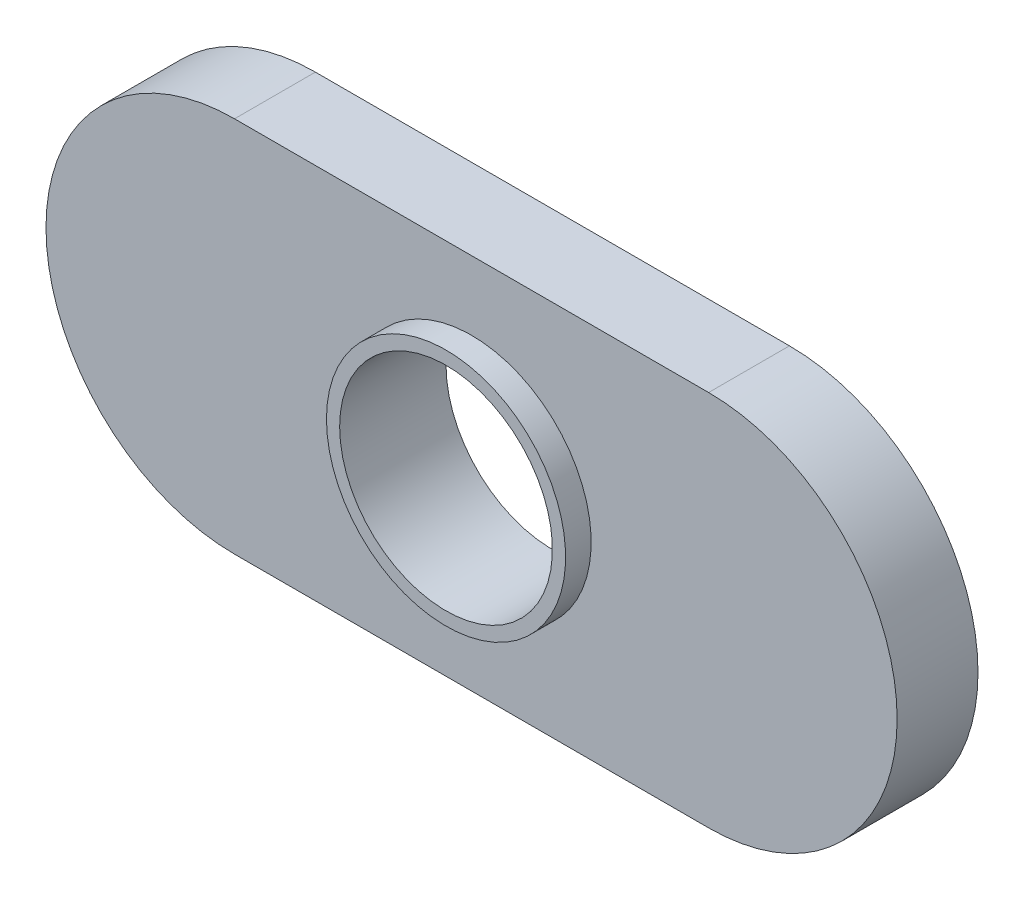
from build123d import *

# Parameters (mm, degrees)
EXTRUDE1_DEPTH     = 2.413
SKETCH4_R          = 3.5687
EXTRUDE3_DEPTH     = 0.762
SKETCH6_R          = 3.175
CUT_EXTRUDE1_DEPTH = 186.722020601


with BuildPart() as part:
    # Sketch1 → Extrude1 (new body)
    with BuildSketch(Plane.XY):
        with BuildLine():
            Line((111.27866266, 131.559165896), (125.42646266, 131.559165896))
            ThreePointArc((125.42646266, 131.559165896), (131.05256266, 125.933065896), (125.42646266, 120.306965896))
            Line((125.42646266, 120.306965896), (111.27866266, 120.306965896))
            ThreePointArc((111.27866266, 120.306965896), (105.65256266, 125.933065896), (111.27866266, 131.559165896))
        make_face()
    extrude(amount=EXTRUDE1_DEPTH)

    # Sketch4 → Extrude3 (add)
    with BuildSketch(Plane.XY.offset(2.413)):
        with Locations(Location((118.35256266, 125.933065896, 0), (0, 0, 180))):
            Circle(SKETCH4_R)
    extrude(amount=EXTRUDE3_DEPTH)

    # Sketch6 → Cut-Extrude1 (cut, through all)
    with BuildSketch(Plane(origin=(0, 0, 0), x_dir=(-1, 0, 0), z_dir=(0, 0, -1))):
        with Locations((-118.35256266, 125.933065896)):
            Circle(SKETCH6_R)
    extrude(amount=-CUT_EXTRUDE1_DEPTH, mode=Mode.SUBTRACT)


solid = part.part
